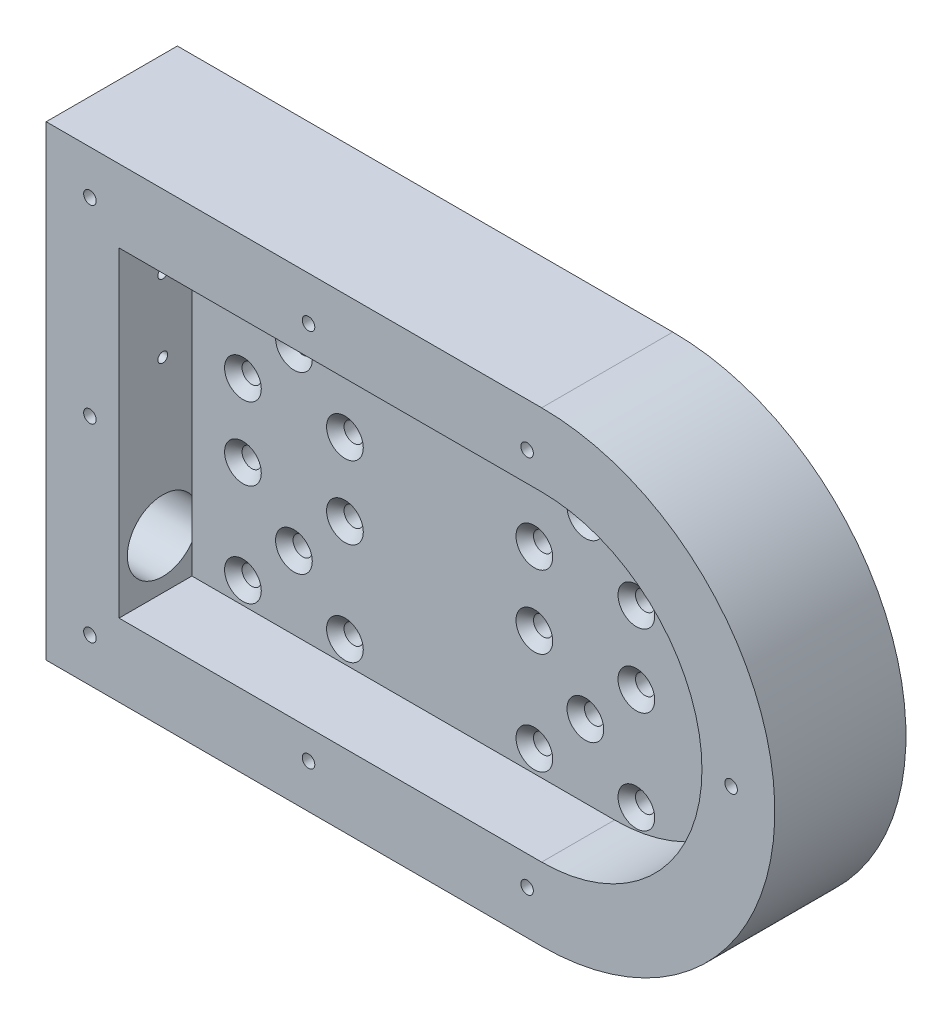
from build123d import *

# Parameters (mm, degrees)
SKETCH1_R                                       = 1.5
BOSS_EXTRUDE1_DEPTH                             = 10
BOSS_EXTRUDE2_START                             = 25
BOSS_EXTRUDE2_DEPTH                             = 25
M4_CLEARANCE_HOLE2_D                            = 4.3
CSK_FOR_M6_FLAT_HEAD_MACHINE_SCREW1_D           = 6.6
CSK_FOR_M6_FLAT_HEAD_MACHINE_SCREW1_CSINK_D     = 12.6
CSK_FOR_M6_FLAT_HEAD_MACHINE_SCREW1_CSINK_ANGLE = 90
SKETCH9_R                                       = 12.15
CUT_EXTRUDE1_DEPTH                              = 25
M3_CLEARANCE_HOLE5_D                            = 3.4
M3_CLEARANCE_HOLE5_DEPTH                        = 25


with BuildPart() as part:
    # Sketch1 → Boss-Extrude1 (new, symmetric)
    with BuildSketch(Plane.XY):
        with BuildLine():
            Line((0, 80), (-170, 80))
            Line((-170, 80), (-170, -80))
            Line((-170, -80), (0, -80))
            ThreePointArc((0, -80), (80, 0), (0, 80))
        make_face()
        with Locations((-155, 65)):
            Circle(SKETCH1_R, mode=Mode.SUBTRACT)
        with Locations((-80, 65)):
            Circle(SKETCH1_R, mode=Mode.SUBTRACT)
        with Locations((-5, 65)):
            Circle(SKETCH1_R, mode=Mode.SUBTRACT)
        with Locations(Location((-155, -65, 0), (0, 0, 180))):
            Circle(SKETCH1_R, mode=Mode.SUBTRACT)
        with Locations(Location((-80, -65, 0), (0, 0, 180))):
            Circle(SKETCH1_R, mode=Mode.SUBTRACT)
        with Locations(Location((-5, -65, 0), (0, 0, 180))):
            Circle(SKETCH1_R, mode=Mode.SUBTRACT)
        with Locations(Location((-155, 0, 0), (0, 0, 180))):
            Circle(SKETCH1_R, mode=Mode.SUBTRACT)
        with Locations((65, 0)):
            Circle(SKETCH1_R, mode=Mode.SUBTRACT)
    extrude(amount=BOSS_EXTRUDE1_DEPTH, both=True)

    # Sketch6 → Boss-Extrude2 (add)
    with BuildSketch(Plane.XY.offset(10).offset(BOSS_EXTRUDE2_START)):
        with BuildLine():
            Line((0, 80), (-170, 80))
            Line((-170, 80), (-170, -80))
            Line((-170, -80), (0, -80))
            ThreePointArc((0, -80), (80, 0), (0, 80))
        make_face()
        with BuildLine():
            Line((0, 55), (-145, 55))
            Line((-145, 55), (-145, -55))
            Line((-145, -55), (0, -55))
            ThreePointArc((0, -55), (55, 0), (0, 55))
        make_face(mode=Mode.SUBTRACT)
    extrude(amount=-BOSS_EXTRUDE2_DEPTH)

    # M4 Clearance Hole2 (through all)
    with Locations(Plane(origin=(0, 0, -10), x_dir=(1, 0, 0), z_dir=(0, 0, -1))):
        with Locations((-5, 65), (-80, 65), (-155, 65), (-155, 0), (-155, -65), (-80, -65), (-5, -65), (65, 0)):
            Hole(M4_CLEARANCE_HOLE2_D / 2)

    # CSK for M6 Flat Head Machine Screw1 (through all)
    with Locations(Plane(origin=(0, 0, 10), x_dir=(-1, 0, 0), z_dir=(0, 0, 1))):
        with Locations((92.5, -12.5), (10, -30), (110, -30), (110, 30), (10, 30), (-7.5, -47.5), (27.5, -47.5), (27.5, -12.5), (-7.5, -12.5), (-7.5, 12.5), (27.5, 12.5), (-7.5, 47.5), (27.5, 47.5), (92.5, 47.5), (92.5, 12.5), (127.5, 12.5), (127.5, 47.5), (127.5, -12.5), (127.5, -47.5), (92.5, -47.5)):
            CounterSinkHole(CSK_FOR_M6_FLAT_HEAD_MACHINE_SCREW1_D / 2, CSK_FOR_M6_FLAT_HEAD_MACHINE_SCREW1_CSINK_D / 2, counter_sink_angle=CSK_FOR_M6_FLAT_HEAD_MACHINE_SCREW1_CSINK_ANGLE)

    # Sketch9 → Cut-Extrude1 (cut)
    with BuildSketch(Plane.ZY.offset(170)):
        with Locations((20, -38)):
            Circle(SKETCH9_R)
    extrude(amount=-CUT_EXTRUDE1_DEPTH, mode=Mode.SUBTRACT)

    # M3 Clearance Hole5
    with Locations(Plane.ZY.offset(170)):
        with Locations((20, 15), (20, 40)):
            Hole(M3_CLEARANCE_HOLE5_D / 2, depth=M3_CLEARANCE_HOLE5_DEPTH)


solid = part.part
